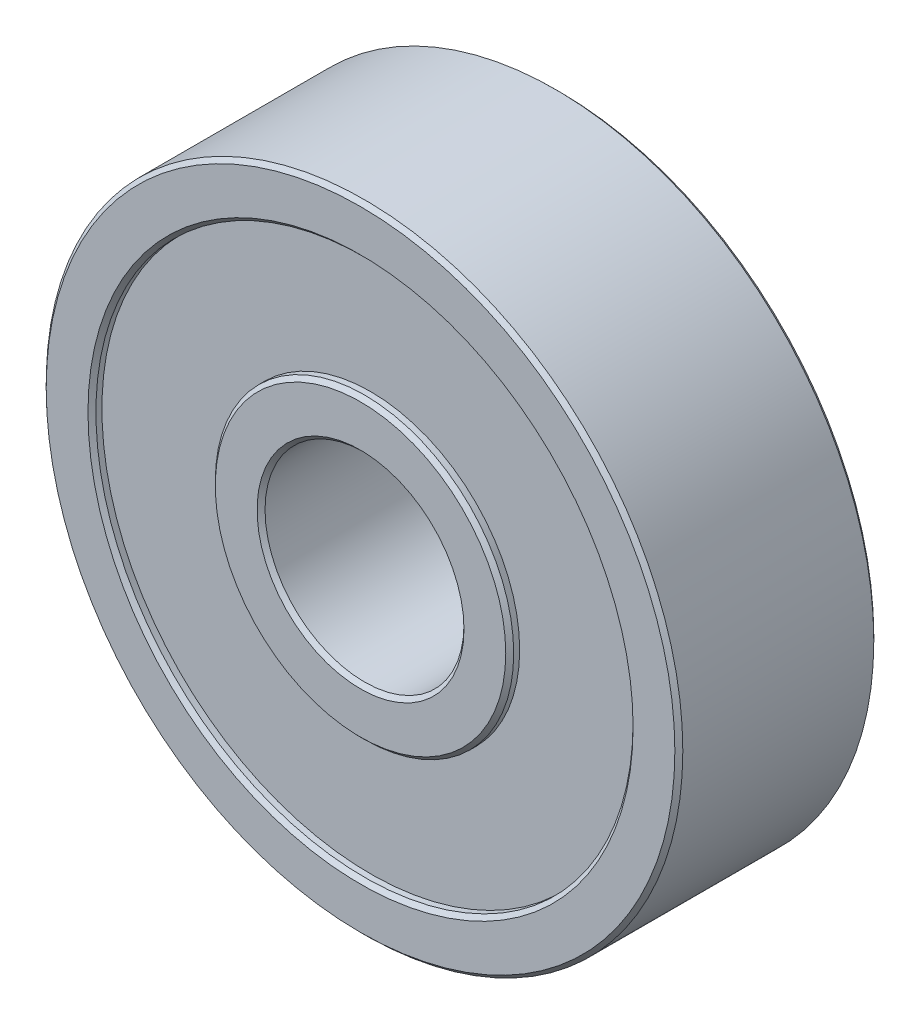
from build123d import *

# Parameters (mm, degrees)
BOSS_EXTRUDE1_DEPTH      = 2.5
BOSS_EXTRUDE1_DEPTH_BACK = 2.5
SKETCH1_R                = 8
SKETCH1_R_2              = 2.5
CUT_EXTRUDE1_START       = -2.5
SKETCH2_R                = 6.75
SKETCH2_R_2              = 3.75
CUT_EXTRUDE1_DEPTH       = 0.25
CUT_EXTRUDE2_START       = 2.25
SKETCH2_2_R              = 6.75
SKETCH2_2_R_2            = 3.75
CUT_EXTRUDE2_DEPTH       = 0.25
CHAMFER1_SIZE            = 0.1


with BuildPart() as part:
    # Sketch1 → Boss-Extrude1 (new, two sides: drawn at the far end of the back side and taken through both)
    with BuildSketch(Plane.XY.offset(-BOSS_EXTRUDE1_DEPTH_BACK)):
        Circle(SKETCH1_R)
        Circle(SKETCH1_R_2, mode=Mode.SUBTRACT)
    extrude(amount=BOSS_EXTRUDE1_DEPTH + BOSS_EXTRUDE1_DEPTH_BACK)

    # Sketch2 → Cut-Extrude1 (cut)
    with BuildSketch(Plane.XY.offset(CUT_EXTRUDE1_START)):
        Circle(SKETCH2_R)
        Circle(SKETCH2_R_2, mode=Mode.SUBTRACT)
    extrude(amount=CUT_EXTRUDE1_DEPTH, mode=Mode.SUBTRACT)

    # Sketch2<2> → Cut-Extrude2 (cut)
    with BuildSketch(Plane.XY.offset(CUT_EXTRUDE2_START)):
        Circle(SKETCH2_2_R)
        Circle(SKETCH2_2_R_2, mode=Mode.SUBTRACT)
    extrude(amount=CUT_EXTRUDE2_DEPTH, mode=Mode.SUBTRACT)

    # Chamfer1
    chamfer1_edges = [part.edges().sort_by_distance(p)[0] for p in [
        (-3.75, 0, -2.5),
        (-6.75, 0, -2.5),
        (-6.75, 0, 2.5),
        (-3.75, 0, 2.5),
        (-8, 0, -2.5),
        (-2.5, 0, -2.5),
        (-8, 0, 2.5),
        (-2.5, 0, 2.5),
    ]]
    chamfer(chamfer1_edges, length=CHAMFER1_SIZE)


solid = part.part
